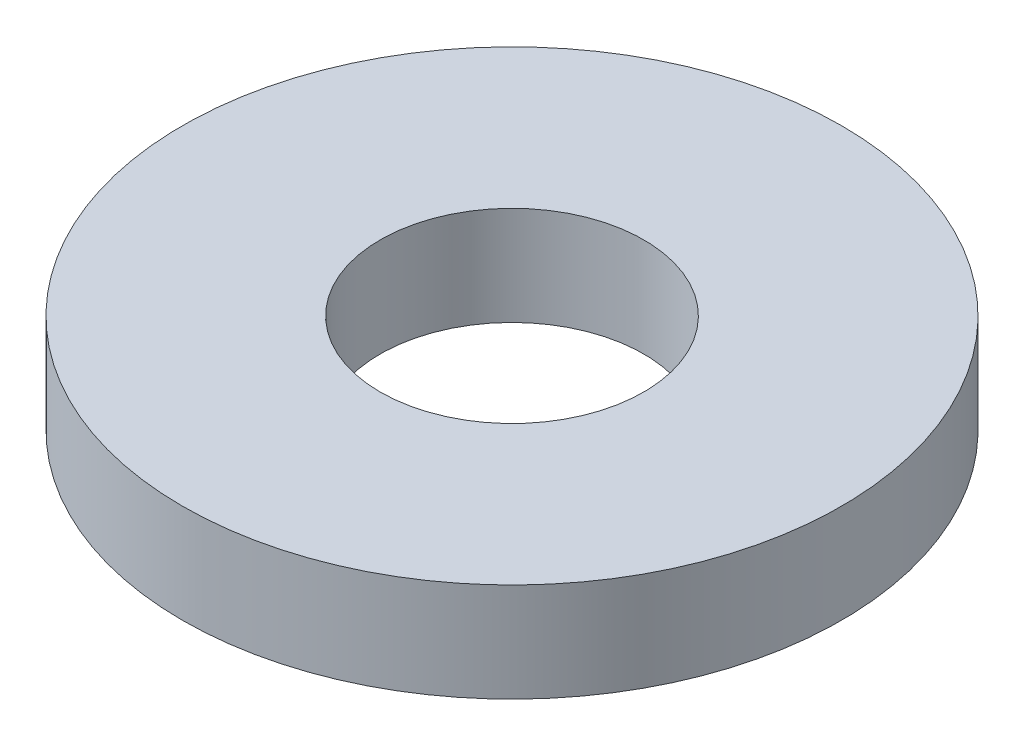
from build123d import *

# Parameters (mm, degrees)
SKETCH1_R           = 10
SKETCH1_R_2         = 4
BOSS_EXTRUDE1_DEPTH = 3


with BuildPart() as part:
    # Sketch1 → Boss-Extrude1 (new body)
    with BuildSketch(Plane(origin=(0, 0, 0), x_dir=(1, 0, 0), z_dir=(0, 1, 0))):
        with Locations(Location((0, 0, 0), (0, 0, 270))):
            Circle(SKETCH1_R)
        with Locations(Location((0, 0, 0), (0, 0, 270))):
            Circle(SKETCH1_R_2, mode=Mode.SUBTRACT)
    extrude(amount=BOSS_EXTRUDE1_DEPTH)


solid = part.part
